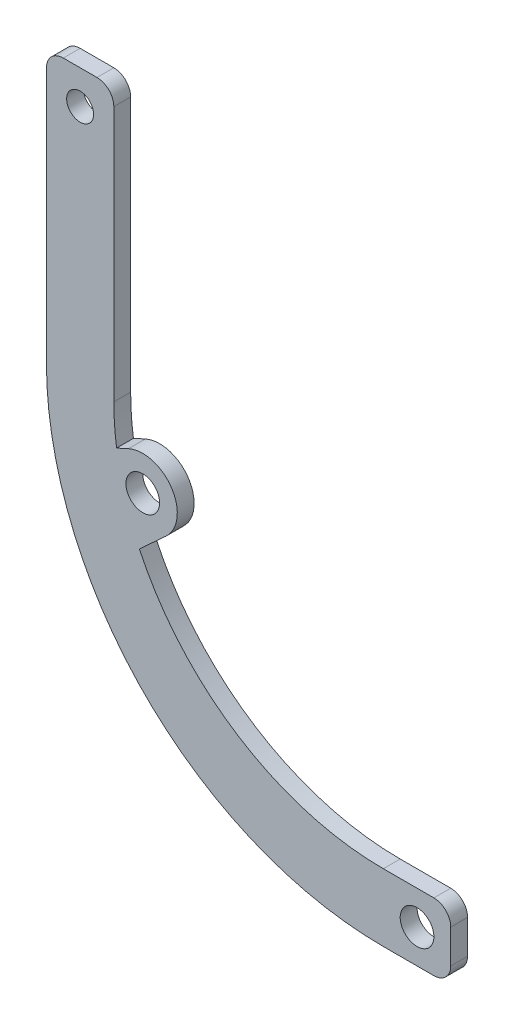
from build123d import *

# Parameters (mm, degrees)
SKETCH1_R           = 5
SKETCH1_R_2         = 4
BOSS_EXTRUDE1_DEPTH = 5
FILLET3_R           = 5


with BuildPart() as part:
    # Sketch1 → Boss-Extrude1 (new body)
    with BuildSketch(Plane.XY):
        with BuildLine():
            Line((-10, 10), (10, 10))
            Line((10, 10), (10, -10))
            Line((10, -10), (-10, -10))
            ThreePointArc((-10, -10), (-80.710678119, 19.289321881), (-110, 90))
            Line((-110, 90), (-110, 170.890270731))
            Line((-110, 170.890270731), (-90, 170.890270731))
            Line((-90, 170.890270731), (-90, 90))
            ThreePointArc((-90, 90), (-89.793525108, 84.256016114), (-89.175166228, 78.541681939))
            Line((-89.175166228, 78.541681939), (-85.65069666, 80.144960069))
            ThreePointArc((-85.65069666, 80.144960069), (-72.859285644, 76.470042175), (-74.483275307, 63.260656311))
            Line((-74.483275307, 63.260656311), (-82.412785145, 55.994286547))
            ThreePointArc((-82.412785145, 55.994286547), (-52.892557185, 22.470535778), (-10, 10))
        make_face()
        Circle(SKETCH1_R, mode=Mode.SUBTRACT)
        with Locations((-100, 160.890270731)):
            Circle(SKETCH1_R_2, mode=Mode.SUBTRACT)
        with Locations((-81.407148813, 70.816413156)):
            Circle(SKETCH1_R, mode=Mode.SUBTRACT)
    extrude(amount=BOSS_EXTRUDE1_DEPTH)

    # Fillet3
    fillet3_edges = [part.edges().sort_by_distance(p)[0] for p in [
        (10, -10, 2.5),
        (-110, 170.890270731, 2.5),
        (-90, 170.890270731, 2.5),
        (10, 10, 2.5),
    ]]
    fillet(fillet3_edges, radius=FILLET3_R)


solid = part.part
